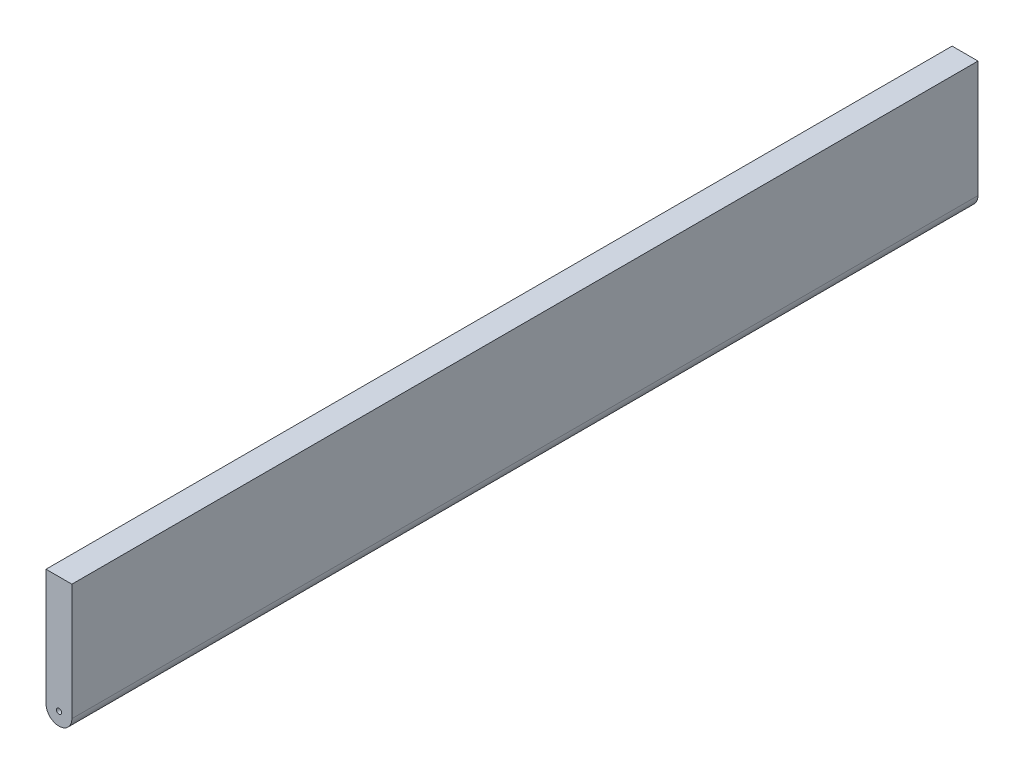
from build123d import *

# Parameters (mm, degrees)
BOSS_EXTRUDE1_DEPTH = 88.9
SKETCH2_R           = 0.254
CUT_EXTRUDE1_DEPTH  = 90.667756189


with BuildPart() as part:
    # Sketch1 → Boss-Extrude1 (new body)
    with BuildSketch(Plane.XY):
        with BuildLine():
            Line((0, 0), (0, 11.43))
            Line((0, 11.43), (2.54, 11.43))
            Line((2.54, 11.43), (2.54, 0))
            ThreePointArc((2.54, 0), (1.27, -1.27), (0, 0))
        make_face()
    extrude(amount=BOSS_EXTRUDE1_DEPTH)

    # Sketch2 → Cut-Extrude1 (cut, through all)
    with BuildSketch(Plane.XY.offset(88.9)):
        with Locations((1.27, 0)):
            Circle(SKETCH2_R)
    extrude(amount=-CUT_EXTRUDE1_DEPTH, mode=Mode.SUBTRACT)


solid = part.part
